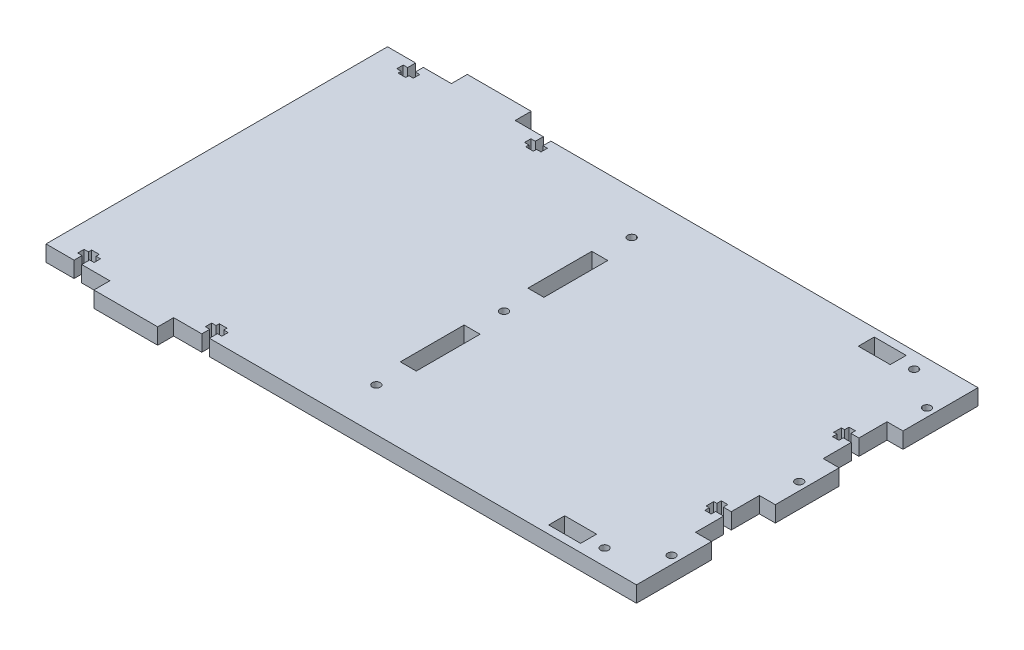
from build123d import *

# Parameters (mm, degrees)
SKETCH1_R           = 1.5875
SKETCH1_W           = 6.35
SKETCH1_H           = 25.4
BOSS_EXTRUDE1_DEPTH = 6.35


with BuildPart() as part:
    # Sketch1 → Boss-Extrude1 (new body)
    with BuildSketch(Plane(origin=(0, 0, 0), x_dir=(1, 0, 0), z_dir=(0, 1, 0))):
        Polygon((-144.607083405, 3.567965739), (-144.607083405, -132.322034261), (-133.431013083, -132.322034261), (-133.431013083, -129.147034261), (-135.183613083, -129.147034261), (-135.183613083, -126.607034261), (-133.431013083, -126.607034261), (-133.431013083, -125.337034261), (-130.383153727, -125.337034261), (-130.383153727, -126.607034261), (-128.630553727, -126.607034261), (-128.630553727, -129.147034261), (-130.383153727, -129.147034261), (-130.383153727, -132.322034261), (-119.207083405, -132.322034261), (-119.207083405, -138.672034261), (-93.807083405, -138.672034261), (-93.807083405, -132.322034261), (-82.631013083, -132.322034261), (-82.631013083, -129.147034261), (-84.383613083, -129.147034261), (-84.383613083, -126.607034261), (-82.631013083, -126.607034261), (-82.631013083, -125.337034261), (-79.583153727, -125.337034261), (-79.583153727, -126.607034261), (-77.830553727, -126.607034261), (-77.830553727, -129.147034261), (-79.583153727, -129.147034261), (-79.583153727, -132.322034261), (-68.407083405, -132.322034261), (83.992916595, -132.322034261), (90.342916595, -132.322034261), (90.342916595, -102.477034261), (83.992916595, -102.477034261), (83.992916595, -91.300963939), (80.817916595, -91.300963939), (80.817916595, -93.053563939), (78.277916595, -93.053563939), (78.277916595, -91.300963939), (77.007916595, -91.300963939), (77.007916595, -88.253104583), (78.277916595, -88.253104583), (78.277916595, -86.500504583), (80.817916595, -86.500504583), (80.817916595, -88.253104583), (83.992916595, -88.253104583), (83.992916595, -77.077034261), (90.342916595, -77.077034261), (90.342916595, -51.677034261), (83.992916595, -51.677034261), (83.992916595, -40.500963939), (80.817916595, -40.500963939), (80.817916595, -42.253563939), (78.277916595, -42.253563939), (78.277916595, -40.500963939), (77.007916595, -40.500963939), (77.007916595, -37.453104583), (78.277916595, -37.453104583), (78.277916595, -35.700504583), (80.817916595, -35.700504583), (80.817916595, -37.453104583), (83.992916595, -37.453104583), (83.992916595, -26.277034261), (90.342916595, -26.277034261), (90.342916595, 3.567965739), (83.992916595, 3.567965739), (-68.407083405, 3.567965739), (-79.583153727, 3.567965739), (-79.583153727, 0.392965739), (-77.830553727, 0.392965739), (-77.830553727, -2.147034261), (-79.583153727, -2.147034261), (-79.583153727, -3.417034261), (-82.631013083, -3.417034261), (-82.631013083, -2.147034261), (-84.383613083, -2.147034261), (-84.383613083, 0.392965739), (-82.631013083, 0.392965739), (-82.631013083, 3.567965739), (-93.807083405, 3.567965739), (-93.807083405, 9.917965739), (-119.207083405, 9.917965739), (-119.207083405, 3.567965739), (-130.383153727, 3.567965739), (-130.383153727, 0.392965739), (-128.630553727, 0.392965739), (-128.630553727, -2.147034261), (-130.383153727, -2.147034261), (-130.383153727, -3.417034261), (-133.431013083, -3.417034261), (-133.431013083, -2.147034261), (-135.183613083, -2.147034261), (-135.183613083, 0.392965739), (-133.431013083, 0.392965739), (-133.431013083, 3.567965739), align=None)
        with Locations(Location((-30.307083405, -13.577034261, 0), (0, 0, 270))):
            Circle(SKETCH1_R, mode=Mode.SUBTRACT)
        with Locations(Location((-30.307083405, -64.377034261, 0), (0, 0, 270))):
            Circle(SKETCH1_R, mode=Mode.SUBTRACT)
        with Locations(Location((-30.307083405, -115.177034261, 0), (0, 0, 270))):
            Circle(SKETCH1_R, mode=Mode.SUBTRACT)
        with Locations(Location((87.167916595, -13.577034261, 0), (0, 0, 270))):
            Circle(SKETCH1_R, mode=Mode.SUBTRACT)
        with Locations(Location((87.167916595, -64.377034261, 0), (0, 0, 270))):
            Circle(SKETCH1_R, mode=Mode.SUBTRACT)
        with Locations(Location((87.167916595, -115.177034261, 0), (0, 0, 270))):
            Circle(SKETCH1_R, mode=Mode.SUBTRACT)
        with Locations(Location((71.292916595, -2.782034261, 0), (0, 0, 270))):
            Circle(SKETCH1_R, mode=Mode.SUBTRACT)
        with Locations(Location((71.292916595, -125.972034261, 0), (0, 0, 270))):
            Circle(SKETCH1_R, mode=Mode.SUBTRACT)
        with Locations((-30.307083405, -38.977034261)):
            Rectangle(SKETCH1_W, SKETCH1_H, mode=Mode.SUBTRACT)
        with Locations((-30.307083405, -89.777034261)):
            Rectangle(SKETCH1_W, SKETCH1_H, mode=Mode.SUBTRACT)
        Polygon((58.592916595, -5.957034261), (52.242916595, -5.957034261), (52.242916595, 0.392965739), (64.942916595, 0.392965739), (64.942916595, -5.957034261), align=None, mode=Mode.SUBTRACT)
        Polygon((58.592916595, -122.797034261), (52.242916595, -122.797034261), (52.242916595, -129.147034261), (64.942916595, -129.147034261), (64.942916595, -122.797034261), align=None, mode=Mode.SUBTRACT)
    extrude(amount=BOSS_EXTRUDE1_DEPTH)


solid = part.part
